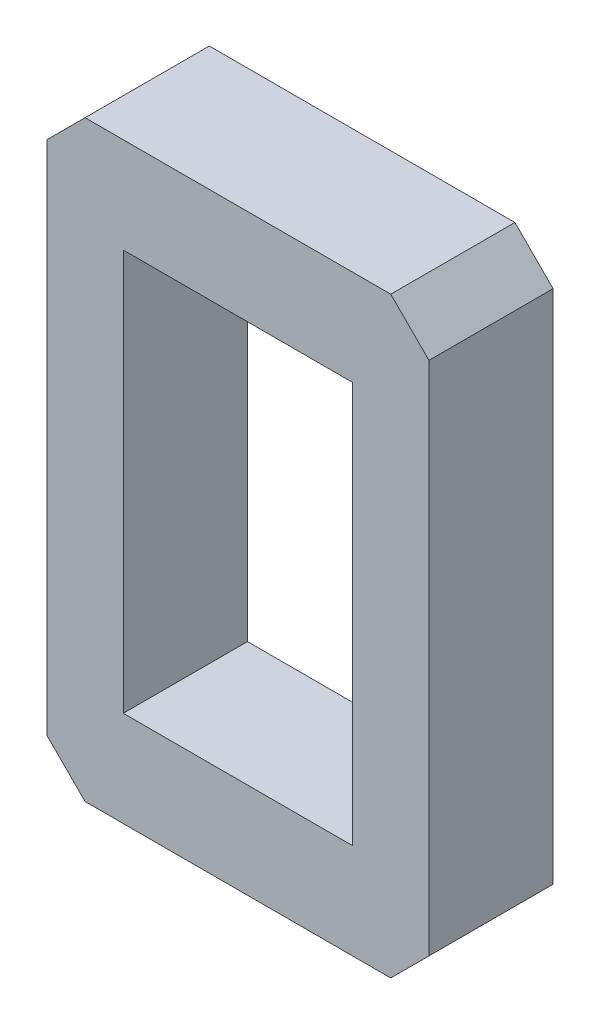
from build123d import *

# Parameters (mm, degrees)
SKETCH1_W           = 20
SKETCH1_H           = 31
SKETCH1_W_2         = 12
SKETCH1_H_2         = 21
BOSS_EXTRUDE1_DEPTH = 6.5
CHAMFER1_SIZE       = 2


with BuildPart() as part:
    # Sketch1 → Boss-Extrude1 (new body)
    with BuildSketch(Plane.XY):
        Rectangle(SKETCH1_W, SKETCH1_H)
        Rectangle(SKETCH1_W_2, SKETCH1_H_2, mode=Mode.SUBTRACT)
    extrude(amount=BOSS_EXTRUDE1_DEPTH)

    # Chamfer1
    chamfer1_edges = [part.edges().sort_by_distance(p)[0] for p in [
        (10, -15.5, 3.25),
        (-10, -15.5, 3.25),
        (-10, 15.5, 3.25),
        (10, 15.5, 3.25),
    ]]
    chamfer(chamfer1_edges, length=CHAMFER1_SIZE)


solid = part.part
